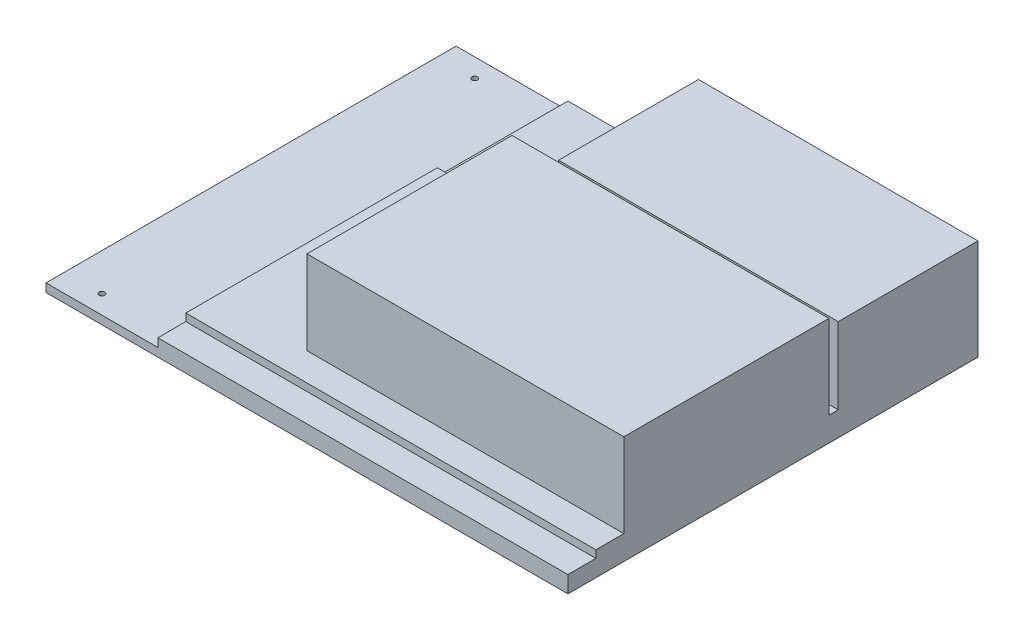
from build123d import *

# Parameters (mm, degrees)
SKETCH1_W           = 220
SKETCH1_H           = 220
BOSS_EXTRUDE1_DEPTH = 4.5
SKETCH2_W           = 220
SKETCH2_H           = 135
BOSS_EXTRUDE2_DEPTH = 4
SKETCH3_W           = 150
SKETCH3_H           = 75
BOSS_EXTRUDE3_DEPTH = 45
SKETCH4_W           = 170
SKETCH4_H           = 110
BOSS_EXTRUDE4_DEPTH = 45
SKETCH5_W           = 280
SKETCH5_H           = 220
BOSS_EXTRUDE5_DEPTH = 4.5
SKETCH6_R           = 1.5
CUT_EXTRUDE1_DEPTH  = 10


with BuildPart() as part:
    # Sketch1 → Boss-Extrude1 (new body)
    with BuildSketch(Plane(origin=(0, 0, 0), x_dir=(1, 0, 0), z_dir=(0, 1, 0))):
        with Locations((-18.301886792, -38.490566038)):
            Rectangle(SKETCH1_W, SKETCH1_H)
    extrude(amount=BOSS_EXTRUDE1_DEPTH)

    # Sketch2 → Boss-Extrude2 (add)
    with BuildSketch(Plane(origin=(0, 4.5, 0), x_dir=(1, 0, 0), z_dir=(0, 1, 0))):
        with Locations((-18.301886792, -65.990566038)):
            Rectangle(SKETCH2_W, SKETCH2_H)
    extrude(amount=BOSS_EXTRUDE2_DEPTH)

    # Sketch3 → Boss-Extrude3 (add)
    with BuildSketch(Plane(origin=(0, 4.5, 0), x_dir=(1, 0, 0), z_dir=(0, 1, 0))):
        with Locations((16.698113208, 34.009433962)):
            Rectangle(SKETCH3_W, SKETCH3_H)
    extrude(amount=BOSS_EXTRUDE3_DEPTH)

    # Sketch4 → Boss-Extrude4 (add)
    with BuildSketch(Plane(origin=(0, 8.5, 0), x_dir=(1, 0, 0), z_dir=(0, 1, 0))):
        with Locations((6.698113208, -63.490566038)):
            Rectangle(SKETCH4_W, SKETCH4_H)
    extrude(amount=BOSS_EXTRUDE4_DEPTH)

    # Sketch5 → Boss-Extrude5 (add)
    with BuildSketch(Plane.XZ):
        with Locations((-48.301886792, 38.490566038)):
            Rectangle(SKETCH5_W, SKETCH5_H)
    extrude(amount=BOSS_EXTRUDE5_DEPTH)

    # Sketch6 → Cut-Extrude1 (cut)
    with BuildSketch(Plane(origin=(0, 0, 0), x_dir=(1, 0, 0), z_dir=(0, 1, 0))):
        with Locations(Location((-168.301886792, 61.509433962, 0), (0, 0, 270))):
            Circle(SKETCH6_R)
        with Locations(Location((-168.301886792, -138.490566038, 0), (0, 0, 270))):
            Circle(SKETCH6_R)
    extrude(amount=-CUT_EXTRUDE1_DEPTH, mode=Mode.SUBTRACT)


solid = part.part
